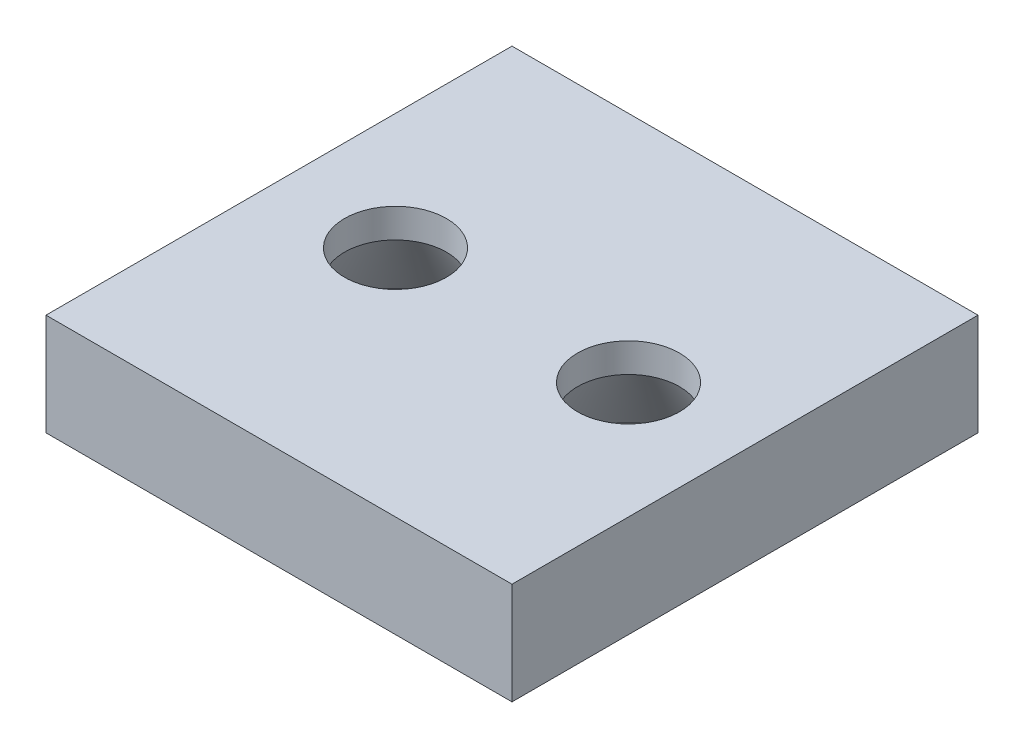
from build123d import *

# Parameters (mm, degrees)
SKETCH1_W           = 32
SKETCH1_H           = 32
BOSS_EXTRUDE2_DEPTH = 7
LPATTERN1_COUNT     = 2
LPATTERN1_PITCH     = 16


with BuildPart() as part:
    # Sketch1 → Boss-Extrude2 (new body)
    with BuildSketch(Plane(origin=(0, 0, 0), x_dir=(1, 0, 0), z_dir=(0, 1, 0))):
        Rectangle(SKETCH1_W, SKETCH1_H)
    extrude(amount=BOSS_EXTRUDE2_DEPTH)

    # Sketch2 → CSK for M2 Flat Head Machine Screw1 (revolve, cut)
    with BuildSketch(Plane(origin=(8, 0, 0), x_dir=(0, 0, -1), z_dir=(1, 0, 0))):
        Polygon((0, 0), (0, 18.103012167), (3.5, 16), (3.5, 4.999754046), (6.5, 0), align=None)
    csk_for_m2_flat_head_machine_screw1 = revolve(axis=Axis((8, -6.35, 0), (0, 1, 0)), mode=Mode.SUBTRACT)

    # LPattern1: CSK for M2 Flat Head Machine Screw1 ×2
    with Locations(*[(-i * LPATTERN1_PITCH, 0, 0) for i in range(1, LPATTERN1_COUNT)]):
        add(csk_for_m2_flat_head_machine_screw1, mode=Mode.SUBTRACT)


solid = part.part
